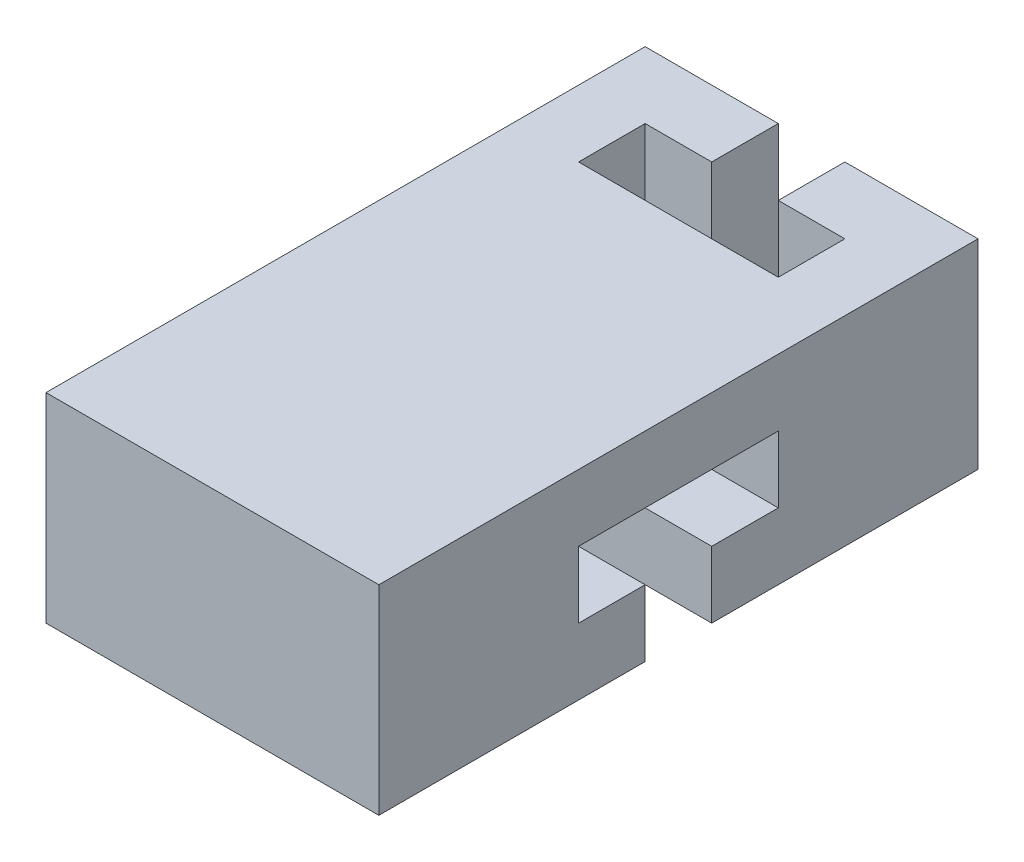
from build123d import *

# Parameters (mm, degrees)
BOSS_EXTRUDE1_DEPTH = 250
CUT_EXTRUDE1_DEPTH  = 250


with BuildPart() as part:
    # Sketch2 → Boss-Extrude1 (new body)
    with BuildSketch(Plane(origin=(0, 0, 0), x_dir=(0, 0, -1), z_dir=(1, 0, 0))):
        Polygon((-25, -75), (-25, -25), (-75, -25), (-75, 25), (75, 25), (75, -25), (25, -25), (25, -75), (225, -75), (225, 75), (-225, 75), (-225, -75), align=None)
    extrude(amount=-BOSS_EXTRUDE1_DEPTH)

    # Sketch3 → Cut-Extrude1 (cut)
    with BuildSketch(Plane(origin=(0, 75, 0), x_dir=(1, 0, 0), z_dir=(0, 1, 0))):
        Polygon((-100, 225), (-100, 175), (-50, 175), (-50, 125), (-200, 125), (-200, 175), (-150, 175), (-150, 225), align=None)
    extrude(amount=-CUT_EXTRUDE1_DEPTH, mode=Mode.SUBTRACT)


solid = part.part
